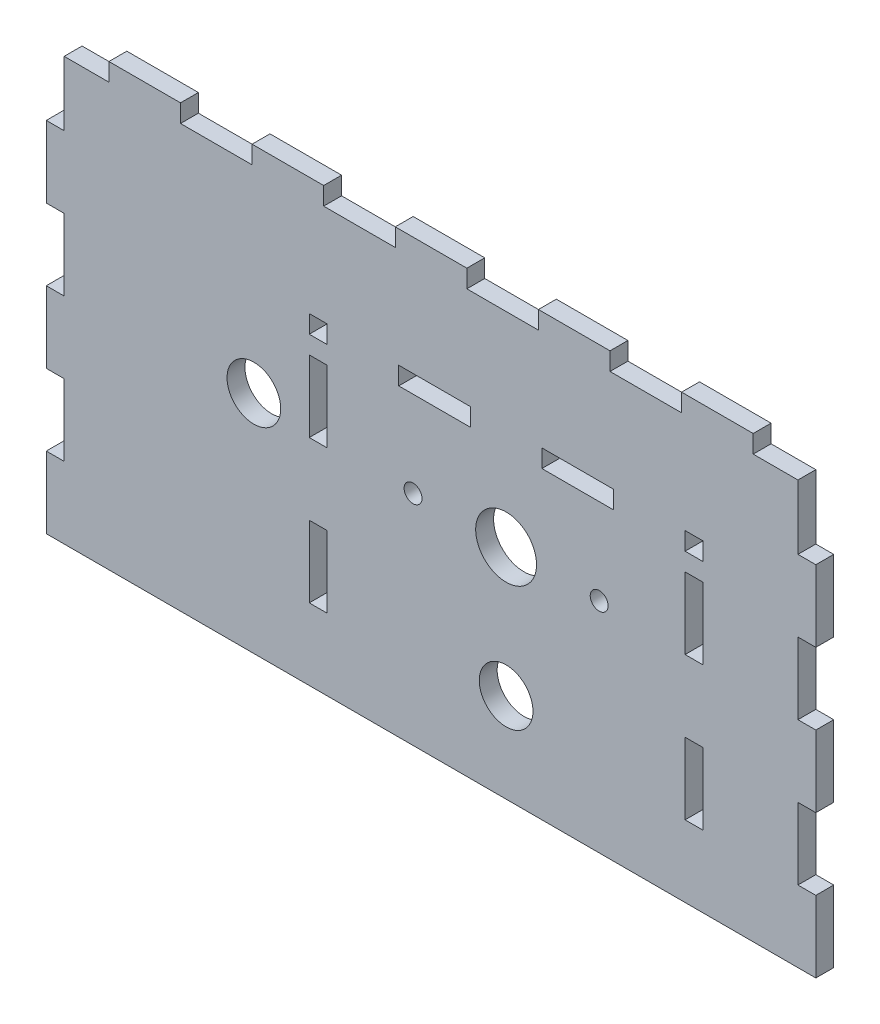
from build123d import *

# Parameters (mm, degrees)
SKETCH_1_W               = 205
SKETCH_1_H               = 118
SKETCH_1_R               = 8.5
SKETCH_1_R_2             = 7.5
SKETCH_1_R_3             = 2.5
EXTRUDE_1_DEPTH          = 5
SKETCH_2_W               = 5
SKETCH_2_H               = 20
EXTRUDE_2_DEPTH          = 5
PATTERN_LINEAR_2_COUNT   = 3
PATTERN_LINEAR_2_PITCH   = 40
MIRROR_2_COPY_1_SKETCH_W = 5
MIRROR_2_COPY_1_SKETCH_H = 20
MIRROR_2_COPY_1_DEPTH    = 5
MIRROR_2_COPY_2_SKETCH_W = 5
MIRROR_2_COPY_2_SKETCH_H = 20
MIRROR_2_COPY_2_DEPTH    = 5
SKETCH_3_W               = 20
SKETCH_3_H               = 5
EXTRUDE_3_DEPTH          = 5
PATTERN_LINEAR_3_COUNT   = 3
PATTERN_LINEAR_3_PITCH   = 40
PATTERN_LINEAR_4_COUNT   = 3
PATTERN_LINEAR_4_PITCH   = 40
SKETCH_5_W               = 5
SKETCH_5_H               = 20
CUT_EXTRUDE_1_DEPTH      = 5
PATTERN_LINEAR_5_COUNT   = 2
PATTERN_LINEAR_5_PITCH   = 40
SKETCH_5_3_W             = 20
SKETCH_5_3_H             = 5
CUT_EXTRUDE_2_DEPTH      = 5
PATTERN_LINEAR_6_COUNT   = 2
PATTERN_LINEAR_6_PITCH   = 40
SKETCH_6_W               = 5
SKETCH_6_H               = 5
CUT_EXTRUDE_3_DEPTH      = 5


with BuildPart() as part:
    # 스케치1 → 보스-돌출1 (new body)
    with BuildSketch(Plane.XY):
        Rectangle(SKETCH_1_W, SKETCH_1_H)
        with Locations((20.971625496, 2)):
            Circle(SKETCH_1_R, mode=Mode.SUBTRACT)
        with Locations((-49.5, 4)):
            Circle(SKETCH_1_R_2, mode=Mode.SUBTRACT)
        with Locations((-5.028374504, 2)):
            Circle(SKETCH_1_R_3, mode=Mode.SUBTRACT)
        with Locations((46.971625496, 2)):
            Circle(SKETCH_1_R_3, mode=Mode.SUBTRACT)
        with Locations((20.971625496, -34)):
            Circle(SKETCH_1_R_2, mode=Mode.SUBTRACT)
    extrude(amount=EXTRUDE_1_DEPTH)

    # 스케치2 → 보스-돌출2 (add)
    with BuildSketch(Plane.XY.offset(5)):
        with Locations((105, -49)):
            Rectangle(SKETCH_2_W, SKETCH_2_H)
    extrude_2 = extrude(amount=-EXTRUDE_2_DEPTH)

    # 선형 패턴2: 보스-돌출2 ×3
    with Locations(*[(0, i * PATTERN_LINEAR_2_PITCH, 0) for i in range(1, PATTERN_LINEAR_2_COUNT)]):
        add(extrude_2)

    # 대칭 복사2: 보스-돌출2 across plane
    add(extrude_2.mirror(Plane(origin=(0, 0, 0), x_dir=(0, 0, 1), z_dir=(1, 0, 0))))

    # 대칭 복사2 copy 1 sketch → 대칭 복사2 copy 1 (add)
    with BuildSketch(Plane(origin=(0, 40, 5), x_dir=(-1, 0, 0), z_dir=(0, 0, 1))):
        with Locations((105, 49)):
            Rectangle(MIRROR_2_COPY_1_SKETCH_W, MIRROR_2_COPY_1_SKETCH_H)
    extrude(amount=-MIRROR_2_COPY_1_DEPTH)

    # 대칭 복사2 copy 2 sketch → 대칭 복사2 copy 2 (add)
    with BuildSketch(Plane(origin=(0, 80, 5), x_dir=(-1, 0, 0), z_dir=(0, 0, 1))):
        with Locations((105, 49)):
            Rectangle(MIRROR_2_COPY_2_SKETCH_W, MIRROR_2_COPY_2_SKETCH_H)
    extrude(amount=-MIRROR_2_COPY_2_DEPTH)

    # 스케치3 → 보스-돌출3 (add)
    with BuildSketch(Plane.XY.offset(5)):
        with Locations((0, 61.5)):
            Rectangle(SKETCH_3_W, SKETCH_3_H)
    extrude_3 = extrude(amount=-EXTRUDE_3_DEPTH)

    # 선형 패턴3: 보스-돌출3 ×3
    with Locations(*[(i * PATTERN_LINEAR_3_PITCH, 0, 0) for i in range(1, PATTERN_LINEAR_3_COUNT)]):
        add(extrude_3)

    # 선형 패턴4: 보스-돌출3 ×3
    with Locations(*[(-i * PATTERN_LINEAR_4_PITCH, 0, 0) for i in range(1, PATTERN_LINEAR_4_COUNT)]):
        add(extrude_3)

    # 스케치5 → 컷-돌출1 (cut)
    with BuildSketch(Plane.XY.offset(5)):
        with Locations((73.471625496, -29)):
            Rectangle(SKETCH_5_W, SKETCH_5_H)
        with Locations((-31.528374504, -29)):
            Rectangle(SKETCH_5_W, SKETCH_5_H)
    cut_extrude_1 = extrude(amount=-CUT_EXTRUDE_1_DEPTH, mode=Mode.SUBTRACT)

    # 선형 패턴5: 컷-돌출1 ×2
    with Locations(*[(0, i * PATTERN_LINEAR_5_PITCH, 0) for i in range(1, PATTERN_LINEAR_5_COUNT)]):
        add(cut_extrude_1, mode=Mode.SUBTRACT)

    # 스케치5<3> → 컷-돌출2 (cut)
    with BuildSketch(Plane.XY.offset(5)):
        with Locations((40.971625496, 28.5)):
            Rectangle(SKETCH_5_3_W, SKETCH_5_3_H)
    cut_extrude_2 = extrude(amount=-CUT_EXTRUDE_2_DEPTH, mode=Mode.SUBTRACT)

    # 선형 패턴6: 컷-돌출2 ×2
    with Locations(*[(-i * PATTERN_LINEAR_6_PITCH, 0, 0) for i in range(1, PATTERN_LINEAR_6_COUNT)]):
        add(cut_extrude_2, mode=Mode.SUBTRACT)

    # 스케치6 → 컷-돌출3 (cut)
    with BuildSketch(Plane.XY.offset(5)):
        with Locations((73.471625496, 28.5)):
            Rectangle(SKETCH_6_W, SKETCH_6_H)
        with Locations((-31.528374504, 28.5)):
            Rectangle(SKETCH_6_W, SKETCH_6_H)
    extrude(amount=-CUT_EXTRUDE_3_DEPTH, mode=Mode.SUBTRACT)


solid = part.part
